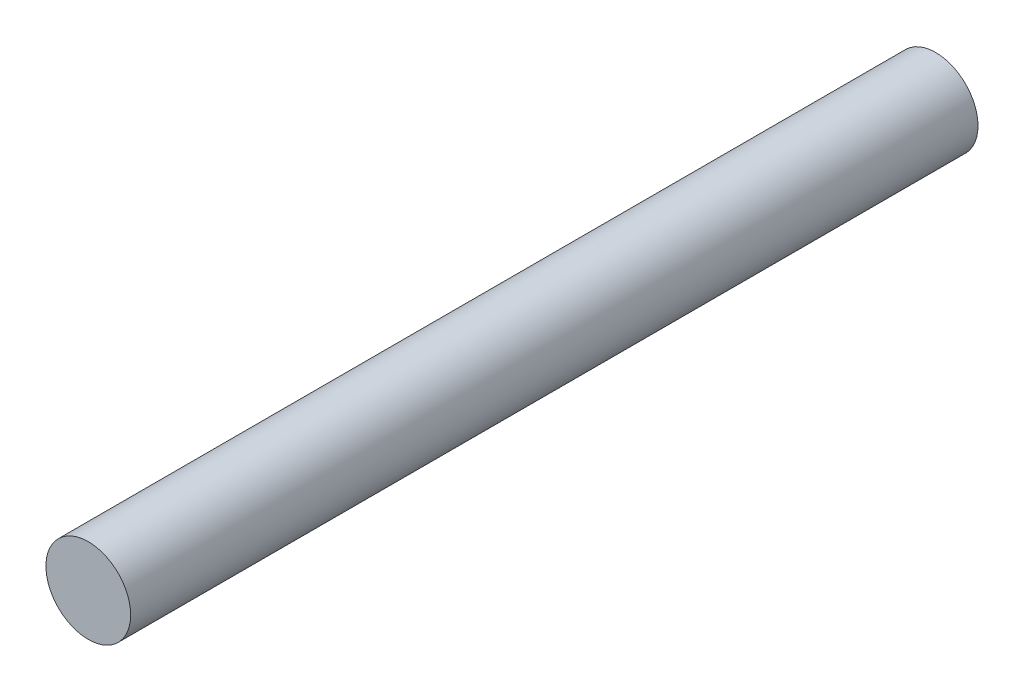
from build123d import *

# Parameters (mm, degrees)
SKETCH1_R           = 1
BOSS_EXTRUDE1_DEPTH = 20


with BuildPart() as part:
    # Sketch1 → Boss-Extrude1 (new body)
    with BuildSketch(Plane.XY):
        Circle(SKETCH1_R)
    extrude(amount=BOSS_EXTRUDE1_DEPTH)


solid = part.part
